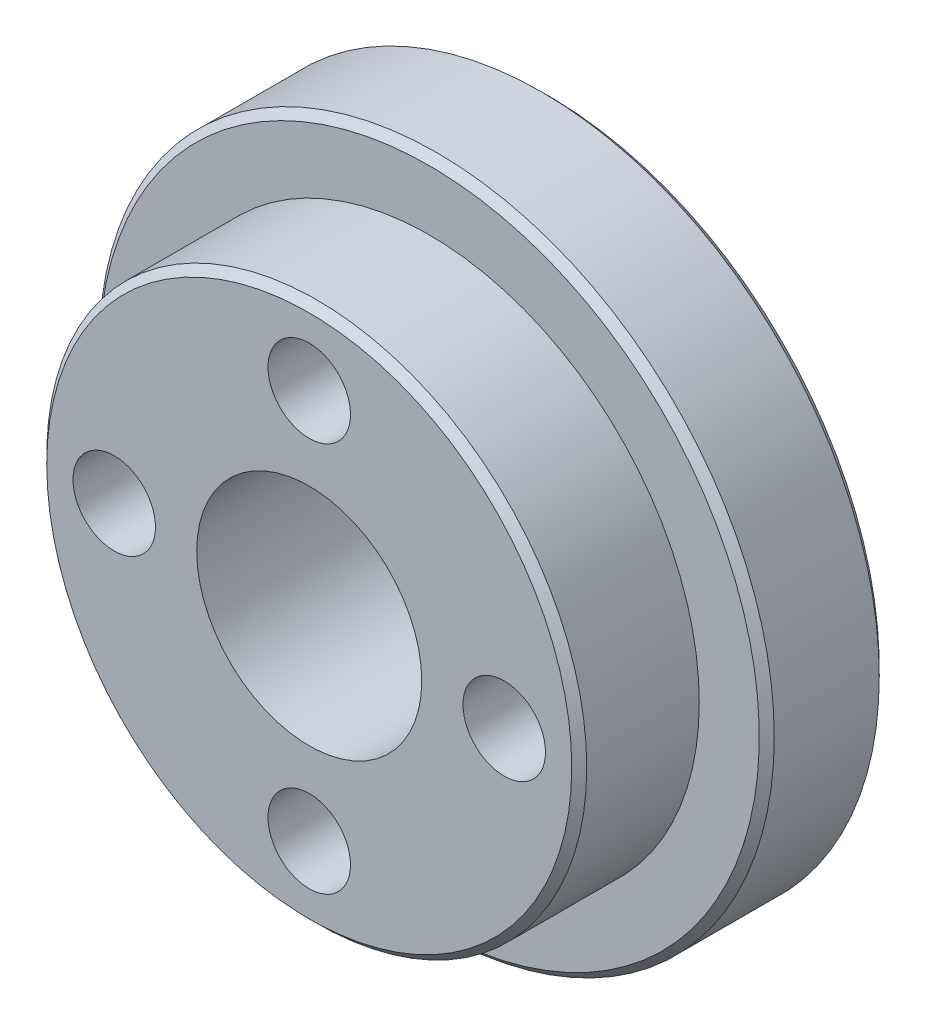
from build123d import *

# Parameters (mm, degrees)
SKETCH1_R                      = 18
BOSS_EXTRUDE1_DEPTH            = 8
SKETCH2_R                      = 22.5
BOSS_EXTRUDE2_DEPTH            = 8
CHAMFER1_SIZE                  = 0.5
SKETCH3_R                      = 7.5
CUT_EXTRUDE1_DEPTH             = 36.616007637
CBORE_FOR_M5_SHCS1_D           = 5.5
CBORE_FOR_M5_SHCS1_CBORE_D     = 9
CBORE_FOR_M5_SHCS1_CBORE_DEPTH = 5
CIRPATTERN1_COUNT              = 4


with BuildPart() as part:
    # Sketch1 → Boss-Extrude1 (new body)
    with BuildSketch(Plane.XY):
        Circle(SKETCH1_R)
    extrude(amount=BOSS_EXTRUDE1_DEPTH)

    # Sketch2 → Boss-Extrude2 (add)
    with BuildSketch(Plane(origin=(0, 0, 0), x_dir=(-1, 0, 0), z_dir=(0, 0, -1))):
        Circle(SKETCH2_R)
    extrude(amount=BOSS_EXTRUDE2_DEPTH)

    # Chamfer1
    chamfer1_edges = [part.edges().sort_by_distance(p)[0] for p in [
        (-18, 0, 8),
        (22.5, 0, 0),
        (22.5, 0, -8),
    ]]
    chamfer(chamfer1_edges, length=CHAMFER1_SIZE)

    # Sketch3 → Cut-Extrude1 (cut, through all)
    with BuildSketch(Plane(origin=(0, 0, -8), x_dir=(-1, 0, 0), z_dir=(0, 0, -1))):
        Circle(SKETCH3_R)
    extrude(amount=-CUT_EXTRUDE1_DEPTH, mode=Mode.SUBTRACT)

    # CBORE for M5 SHCS1 (through all)
    with Locations(Plane(origin=(0, 0, -8), x_dir=(-1, 0, 0), z_dir=(0, 0, -1))):
        with Locations((0, 13)):
            cbore_for_m5_shcs1 = CounterBoreHole(CBORE_FOR_M5_SHCS1_D / 2, CBORE_FOR_M5_SHCS1_CBORE_D / 2, CBORE_FOR_M5_SHCS1_CBORE_DEPTH)

    # CirPattern1: CBORE for M5 SHCS1 ×4 about axis
    cirpattern1_axis = Axis((0, 0, 0), (0, 0, 1))
    for i in range(1, CIRPATTERN1_COUNT):
        add(cbore_for_m5_shcs1.rotate(cirpattern1_axis, i * 360 / CIRPATTERN1_COUNT), mode=Mode.SUBTRACT)


solid = part.part
